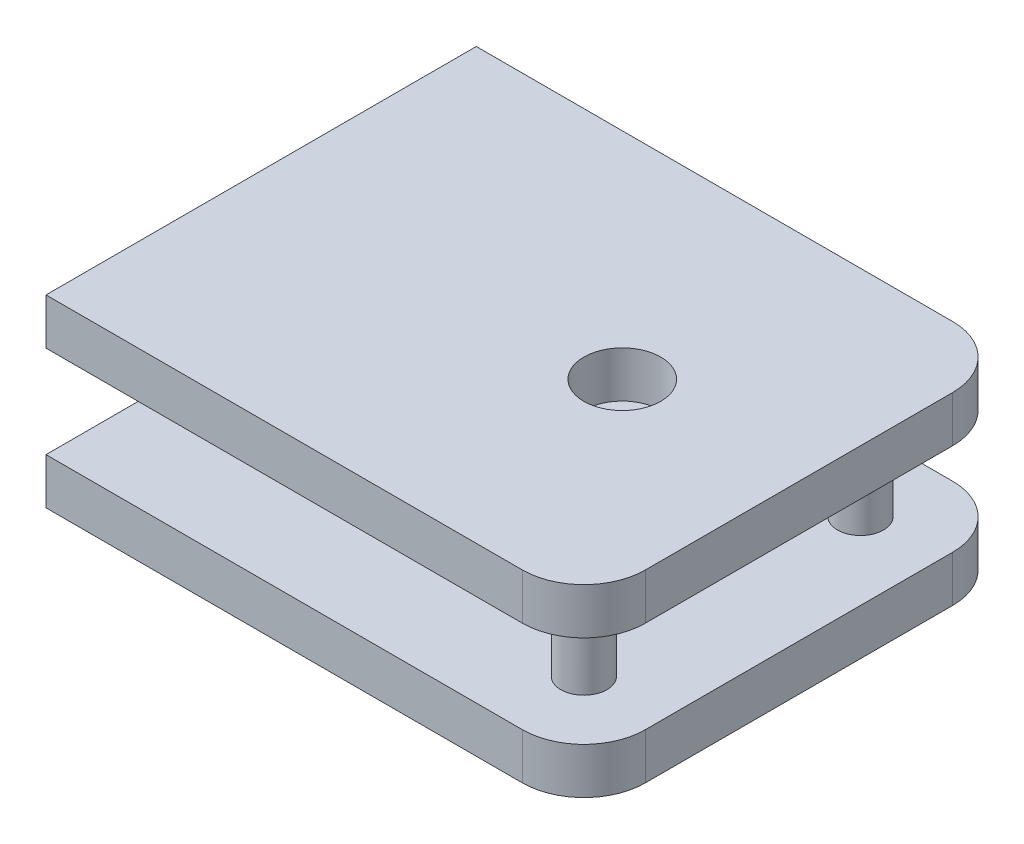
from build123d import *

# Parameters (mm, degrees)
SALIENTE_EXTRUIR1_DEPTH = 3
CROQUIS2_R              = 1.5
SALIENTE_EXTRUIR2_DEPTH = 6
SALIENTE_EXTRUIR3_START = 3
SALIENTE_EXTRUIR3_DEPTH = 3
CORTAR_EXTRUIR1_REACH   = 194.159
CROQUIS4_R              = 2.5


with BuildPart() as part:
    # Croquis1 → Saliente-Extruir1 (new body)
    with BuildSketch(Plane(origin=(0, 175.405960568, 0), x_dir=(-1, 0, 0), z_dir=(0, -1, 0))):
        with BuildLine():
            Line((159.062896708, 2.364392951), (190.062896708, 2.364392951))
            Line((190.062896708, 2.364392951), (190.062896708, -25.635607049))
            Line((190.062896708, -25.635607049), (159.062896708, -25.635607049))
            ThreePointArc((159.062896708, -25.635607049), (156.234469583, -24.464034173), (155.062896708, -21.635607049))
            Line((155.062896708, -21.635607049), (155.062896708, -1.635607049))
            ThreePointArc((155.062896708, -1.635607049), (156.234469583, 1.192820076), (159.062896708, 2.364392951))
        make_face()
    extrude(amount=SALIENTE_EXTRUIR1_DEPTH)

    # Croquis2 → Saliente-Extruir2 (add)
    with BuildSketch(Plane(origin=(0, 175.405960568, 0), x_dir=(1, 0, 0), z_dir=(0, 1, 0))):
        with Locations(Location((-160.062896708, -2.635607049, 0), (0, 0, 90))):
            Circle(CROQUIS2_R)
        with Locations(Location((-160.062896708, -20.635607049, 0), (0, 0, 90))):
            Circle(CROQUIS2_R)
    extrude(amount=SALIENTE_EXTRUIR2_DEPTH)

    # Croquis3 → Saliente-Extruir3 (add)
    with BuildSketch(Plane(origin=(0, 181.405960568, 0), x_dir=(1, 0, 0), z_dir=(0, 1, 0)).offset(SALIENTE_EXTRUIR3_START)):
        with BuildLine():
            Line((-190.062896708, 2.364392951), (-190.062896708, -25.635607049))
            Line((-190.062896708, -25.635607049), (-159.062896708, -25.635607049))
            ThreePointArc((-159.062896708, -25.635607049), (-156.234469583, -24.464034173), (-155.062896708, -21.635607049))
            Line((-155.062896708, -21.635607049), (-155.062896708, -1.635607049))
            ThreePointArc((-155.062896708, -1.635607049), (-156.234469583, 1.192820076), (-159.062896708, 2.364392951))
            Line((-159.062896708, 2.364392951), (-190.062896708, 2.364392951))
        make_face()
    extrude(amount=-SALIENTE_EXTRUIR3_DEPTH)

    # Cortar-Extruir1: up to this face of the body (flat: up to its plane)
    cortar_extruir1_end = Plane(part.part.faces().sort_by_distance((-172.680086606, 172.405960568, 11.635607049))[0])
    # Croquis4 → Cortar-Extruir1 (cut, up to the picked face)
    with BuildSketch(Plane(origin=(0, 184.405960568, 0), x_dir=(1, 0, 0), z_dir=(0, 1, 0)), mode=Mode.PRIVATE) as cortar_extruir1_sk1:
        with Locations(Location((-166.562896708, -11.635607049, 0), (0, 0, 270))):
            Circle(CROQUIS4_R)
    cortar_extruir1_tool1 = split(extrude(cortar_extruir1_sk1.sketch, amount=-CORTAR_EXTRUIR1_REACH, mode=Mode.PRIVATE), bisect_by=cortar_extruir1_end, keep=Keep.BOTH, mode=Mode.PRIVATE)
    add(cortar_extruir1_tool1.solids().sort_by(Axis((-166.562897, 184.405961, 11.635607), (0, -1, 0)))[0], mode=Mode.SUBTRACT)


solid = part.part
